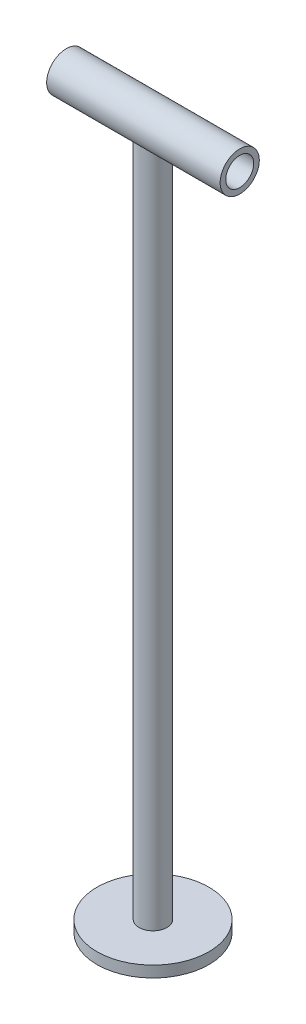
from build123d import *

# Parameters (mm, degrees)
KLIP_SKETCH1_R                = 100
KLIP_BOSS_EXTRUDE1_DEPTH      = 20
KLIP_BOSS_EXTRUDE3_DEPTH      = 155
KLIP_BOSS_EXTRUDE3_DEPTH_BACK = 155
KLIP_SKETCH3_R                = 35
KLIP_SKETCH3_R_2              = 25
KLIP_BOSS_EXTRUDE2_REACH      = 1285.326
KLIP_BOSS_EXTRUDE2_END_RADIUS = 35
KLIP_SKETCH2_R                = 25


with BuildPart() as part:
    # klip_Sketch1 → klip_Boss-Extrude1 (new body)
    with BuildSketch(Plane(origin=(0, 0, 0), x_dir=(1, 0, 0), z_dir=(0, 1, 0))):
        Circle(KLIP_SKETCH1_R)
    extrude(amount=-KLIP_BOSS_EXTRUDE1_DEPTH)

    # klip_Boss-Extrude2: up to this cylinder (the profile starts outside it)
    klip_boss_extrude2_end = Plane(origin=(0, 1235, 0), z_dir=(1, 0, 0)) * Cylinder(KLIP_BOSS_EXTRUDE2_END_RADIUS, 2641.652, mode=Mode.PRIVATE)
    # klip_Sketch2 → klip_Boss-Extrude2 (add, up to the surface)
    with BuildSketch(Plane(origin=(0, 0, 0), x_dir=(1, 0, 0), z_dir=(0, 1, 0)), mode=Mode.PRIVATE) as klip_boss_extrude2_sk1:
        Circle(KLIP_SKETCH2_R)
    klip_boss_extrude2_tool1 = extrude(klip_boss_extrude2_sk1.sketch, amount=KLIP_BOSS_EXTRUDE2_REACH, mode=Mode.PRIVATE) - klip_boss_extrude2_end
    add(klip_boss_extrude2_tool1.solids().sort_by_distance((0, 0, 0))[0])


with BuildPart() as body_2:
    # klip_Sketch3 → klip_Boss-Extrude3 (new, two sides: drawn at the far end of the back side and taken through both)
    with BuildSketch(Plane(origin=(0, 0, 0), x_dir=(0, 0, -1), z_dir=(1, 0, 0)).offset(-KLIP_BOSS_EXTRUDE3_DEPTH_BACK)):
        with Locations((0, 1235)):
            Circle(KLIP_SKETCH3_R)
        with Locations((0, 1235)):
            Circle(KLIP_SKETCH3_R_2, mode=Mode.SUBTRACT)
    extrude(amount=KLIP_BOSS_EXTRUDE3_DEPTH + KLIP_BOSS_EXTRUDE3_DEPTH_BACK)


solid = Compound([part.part, body_2.part])
